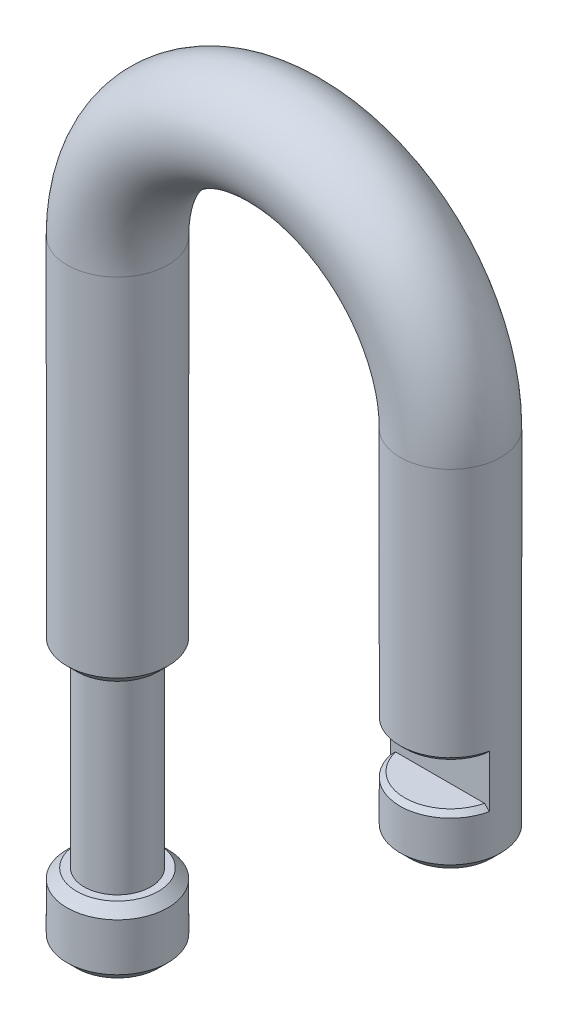
from build123d import *

# Parameters (mm, degrees)
SKETCH2_R          = 5.3
CUT_EXTRUDE1_START = -5.75
CUT_EXTRUDE1_DEPTH = 4.5
CUT_EXTRUDE2_START = -7
SKETCH6_R          = 5.475
SKETCH6_R_2        = 3.5
CUT_EXTRUDE2_DEPTH = 20
CHAMFER1_SIZE      = 1
CHAMFER2_SIZE      = 0.5


with BuildPart() as part:
    # Sweep1: sweep along a path in Sketch1
    with BuildLine(Plane.XY) as sweep1_path:
        Line((0, 0), (0, 64.5))
        ThreePointArc((0, 64.5), (17.5, 82), (35, 64.5))
        Line((35, 64.5), (35, 27.5))
    # Sketch2 → Sweep1 (sweep)
    with BuildSketch(Plane(origin=(0, 0, 0), x_dir=(1, 0, 0), z_dir=(0, 1, 0))):
        Circle(SKETCH2_R)
    sweep(path=sweep1_path.line)

    # Sketch4 → Cut-Extrude1 (cut)
    with BuildSketch(Plane.XZ.offset(-27.5).offset(CUT_EXTRUDE1_START)):
        with BuildLine():
            Line((29.815407441, 1.1), (40.184592559, 1.1))
            ThreePointArc((40.184592559, 1.1), (35, 5.3), (29.815407441, 1.1))
        make_face()
    extrude(amount=-CUT_EXTRUDE1_DEPTH, mode=Mode.SUBTRACT)

    # Sketch6 → Cut-Extrude2 (cut)
    with BuildSketch(Plane.XZ.offset(CUT_EXTRUDE2_START)):
        Circle(SKETCH6_R)
        with Locations(Location((0, 0, 0), (0, 0, 270))):
            Circle(SKETCH6_R_2, mode=Mode.SUBTRACT)
    extrude(amount=-CUT_EXTRUDE2_DEPTH, mode=Mode.SUBTRACT)

    # Chamfer1
    chamfer1_edges = [part.edges().sort_by_distance(p)[0] for p in [
        (40.3, 27.5, 0),
        (-5.3, 7, 0),
        (-5.3, 27, 0),
        (-5.3, 0, 0),
    ]]
    chamfer(chamfer1_edges, length=CHAMFER1_SIZE)

    # Chamfer2
    chamfer2_edges = [part.edges().sort_by_distance(p)[0] for p in [
        (35, 37.75, 5.3),
        (35, 33.25, 5.3),
    ]]
    chamfer(chamfer2_edges, length=CHAMFER2_SIZE)


solid = part.part
